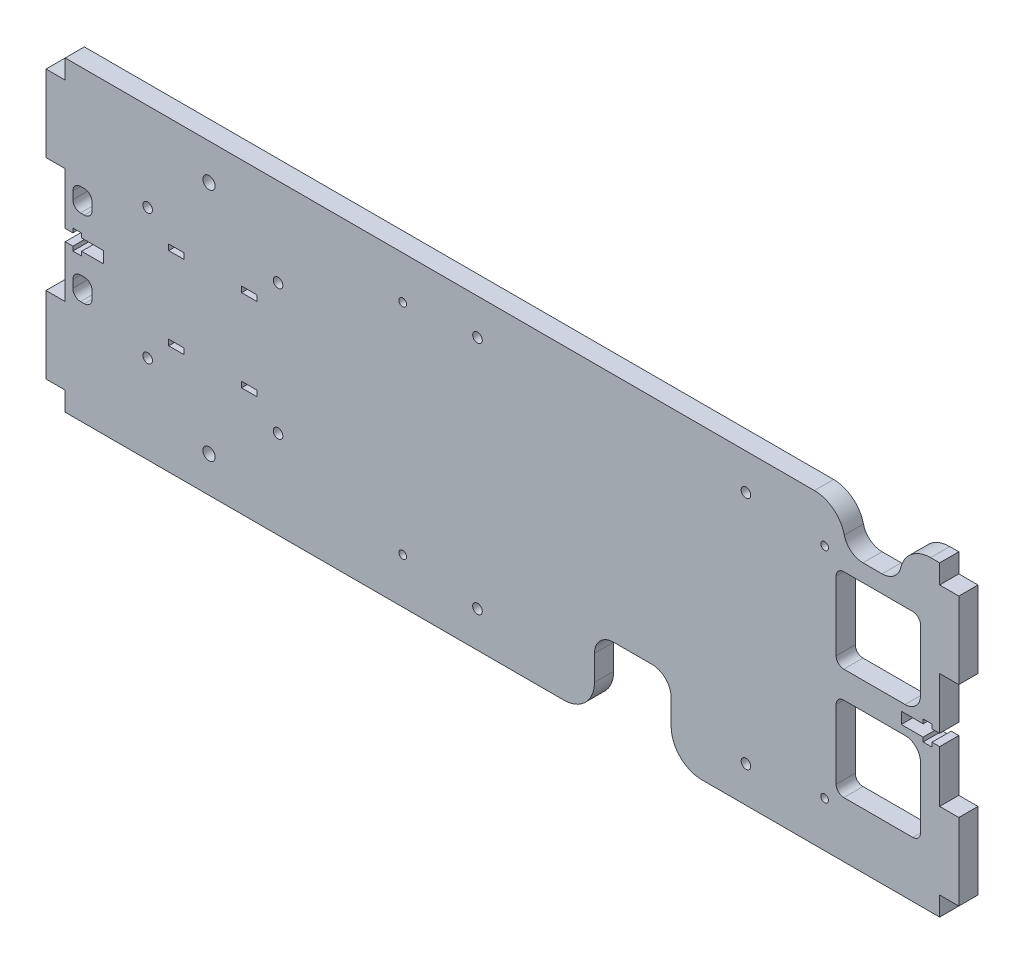
from build123d import *

# Parameters (mm, degrees)
ESQUISSE1_R        = 1
ESQUISSE1_R_2      = 1.25
ESQUISSE1_R_3      = 1.6
ESQUISSE1_W        = 4
ESQUISSE1_H        = 1.5
BOSS_EXTRU_1_DEPTH = 5
SKETCH1_R          = 1.25
SKETCH1_W          = 15
SKETCH1_H          = 10
SKETCH1_W_2        = 5
SKETCH1_H_2        = 6
SKETCH1_W_3        = 20
SKETCH1_H_3        = 20
SKETCH1_W_4        = 22
SKETCH1_H_4        = 22
CUT_EXTRUDE1_DEPTH = 10
FILLET2_R          = 5
FILLET3_R          = 2
CONG_1_R           = 8
CONG_2_R           = 2
CONG_3_R           = 4


with BuildPart() as part:
    # Esquisse1 → Boss.-Extru.1 (new body)
    with BuildSketch(Plane.XY):
        Polygon((0, 35), (0, 15), (5, 15), (5, 1.5), (7, 1.5), (7, 2.6), (9.3, 2.6), (9.3, 1.5), (15, 1.5), (15, -1.5), (9.3, -1.5), (9.3, -2.6), (7, -2.6), (7, -1.5), (5, -1.5), (5, -15), (0, -15), (0, -35), (5, -35), (5, -40), (233, -40), (233, -35), (238, -35), (238, -15), (233, -15), (233, -1.5), (231, -1.5), (231, -2.6), (228.7, -2.6), (228.7, -1.5), (223, -1.5), (223, 1.5), (228.7, 1.5), (228.7, 2.6), (231, 2.6), (231, 1.5), (233, 1.5), (233, 15), (238, 15), (238, 35), (233, 35), (233, 40), (5, 40), (5, 35), align=None)
        with Locations((203, -28.177197641)):
            Circle(ESQUISSE1_R, mode=Mode.SUBTRACT)
        with Locations((203, 28.822802359)):
            Circle(ESQUISSE1_R, mode=Mode.SUBTRACT)
        with Locations((93, -28.177197641)):
            Circle(ESQUISSE1_R, mode=Mode.SUBTRACT)
        with Locations((93, 28.822802359)):
            Circle(ESQUISSE1_R, mode=Mode.SUBTRACT)
        with Locations((112.5, -30.615)):
            Circle(ESQUISSE1_R_2, mode=Mode.SUBTRACT)
        with Locations(Location((42.5, -30.615, 0), (0, 0, 180))):
            Circle(ESQUISSE1_R_3, mode=Mode.SUBTRACT)
        with Locations((182.5, -30.615)):
            Circle(ESQUISSE1_R_2, mode=Mode.SUBTRACT)
        with Locations((42.5, 30.615)):
            Circle(ESQUISSE1_R_3, mode=Mode.SUBTRACT)
        with Locations(Location((182.5, 30.615, 0), (0, 0, 180))):
            Circle(ESQUISSE1_R_2, mode=Mode.SUBTRACT)
        with Locations(Location((112.5, 30.615, 0), (0, 0, 180))):
            Circle(ESQUISSE1_R_2, mode=Mode.SUBTRACT)
        with Locations((34, -10.75)):
            Rectangle(ESQUISSE1_W, ESQUISSE1_H, mode=Mode.SUBTRACT)
        with Locations((34, 10.75)):
            Rectangle(ESQUISSE1_W, ESQUISSE1_H, mode=Mode.SUBTRACT)
        with Locations((53, 10.75)):
            Rectangle(ESQUISSE1_W, ESQUISSE1_H, mode=Mode.SUBTRACT)
        with Locations((53, -10.75)):
            Rectangle(ESQUISSE1_W, ESQUISSE1_H, mode=Mode.SUBTRACT)
    extrude(amount=BOSS_EXTRU_1_DEPTH)

    # Sketch1 → Cut-Extrude1 (cut)
    with BuildSketch(Plane(origin=(0, 0, 0), x_dir=(-1, 0, 0), z_dir=(0, 0, -1))):
        with Locations((-60.5, 17)):
            Circle(SKETCH1_R)
        with Locations((-60.5, -17)):
            Circle(SKETCH1_R)
        with Locations((-26.5, 17)):
            Circle(SKETCH1_R)
        with Locations((-26.5, -17)):
            Circle(SKETCH1_R)
        with Locations((-215.5, 35)):
            Rectangle(SKETCH1_W, SKETCH1_H)
        with Locations((-9.5, 10)):
            Rectangle(SKETCH1_W_2, SKETCH1_H_2)
        with Locations((-153, -30.429903646)):
            Rectangle(SKETCH1_W_3, SKETCH1_H_3)
        with Locations((-9.5, -10)):
            Rectangle(SKETCH1_W_2, SKETCH1_H_2)
        with Locations((-217, 14.5)):
            Rectangle(SKETCH1_W_4, SKETCH1_H_4)
        with Locations((-217, -14.5)):
            Rectangle(SKETCH1_W_4, SKETCH1_H_4)
    extrude(amount=-CUT_EXTRUDE1_DEPTH, mode=Mode.SUBTRACT)

    # Fillet2
    fillet2_edges = [part.edges().sort_by_distance(p)[0] for p in [
        (208, 30, 2.5),
        (223, 30, 2.5),
        (163, -20.429903646, 2.5),
        (143, -20.429903646, 2.5),
    ]]
    fillet(fillet2_edges, radius=FILLET2_R)

    # Fillet3
    fillet3_edges = [part.edges().sort_by_distance(p)[0] for p in [
        (228, -25.5, 2.5),
        (206, -3.5, 2.5),
        (206, -25.5, 2.5),
        (228, 25.5, 2.5),
        (206, 25.5, 2.5),
        (206, 3.5, 2.5),
    ]]
    fillet(fillet3_edges, radius=FILLET3_R)

    # Congé1
    cong_1_edges = [part.edges().sort_by_distance(p)[0] for p in [
        (223, 40, 2.5),
        (208, 40, 2.5),
        (163, -40, 2.5),
        (143, -40, 2.5),
    ]]
    fillet(cong_1_edges, radius=CONG_1_R)

    # Congé2
    cong_2_edges = [part.edges().sort_by_distance(p)[0] for p in [
        (12, 7, 2.5),
        (12, 13, 2.5),
        (7, 13, 2.5),
        (7, 7, 2.5),
        (7, -13, 2.5),
        (12, -13, 2.5),
        (12, -7, 2.5),
        (7, -7, 2.5),
    ]]
    fillet(cong_2_edges, radius=CONG_2_R)

    # Congé3
    cong_3_edges = [part.edges().sort_by_distance(p)[0] for p in [
        (228, -3.5, 2.5),
        (228, 3.5, 2.5),
    ]]
    fillet(cong_3_edges, radius=CONG_3_R)


solid = part.part
